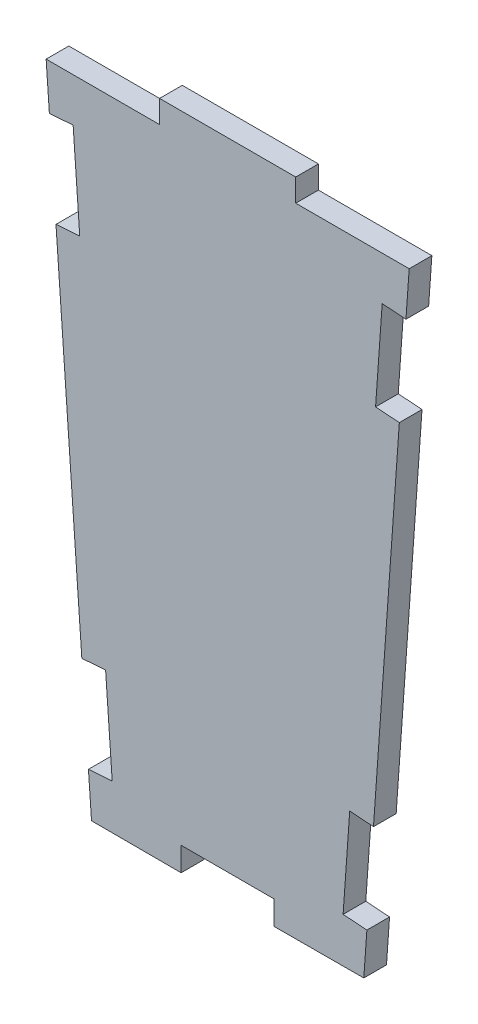
from build123d import *

# Parameters (mm, degrees)
BOSS_EXTRUDE1_DEPTH = 2.5


with BuildPart() as part:
    # Sketch3 → Boss-Extrude1 (new, symmetric)
    with BuildSketch(Plane.XY):
        Polygon((383.496918056, -153.729086599), (383.497024458, -148.47966712), (403.996445189, -148.47966712), (403.99713086, -153.729086599), (423.747024458, -153.683245157), (424.423262183, -144.191572442), (419.186535917, -143.818479947), (420.64337328, -123.370310716), (425.880099547, -123.743403211), (431.577507119, -43.77459053), (426.340780852, -43.401498034), (427.797618216, -22.953328803), (433.034344482, -23.326421299), (433.747024458, -13.323245157), (408.747024458, -13.323245157), (408.747024458, -8.323245157), (378.747024458, -8.323245157), (378.747024458, -13.323245157), (353.747024458, -13.323245157), (354.459704434, -23.326421299), (359.6964307, -22.953328803), (361.153268064, -43.401498034), (355.916541797, -43.77459053), (361.613949369, -123.743403211), (366.850675636, -123.370310716), (368.307512999, -143.818479947), (363.070786733, -144.191572442), (363.747024458, -153.683245157), align=None)
    extrude(amount=BOSS_EXTRUDE1_DEPTH, both=True)


solid = part.part
